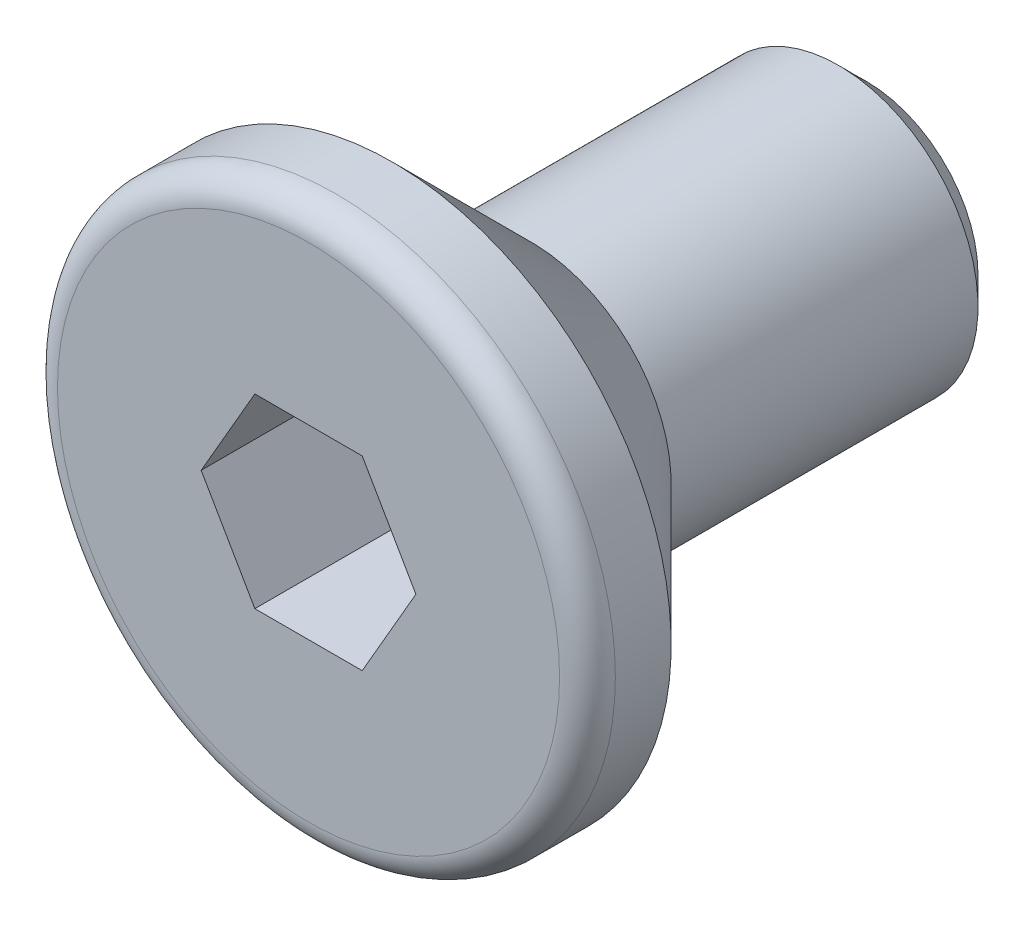
from build123d import *

# Parameters (mm, degrees)
CUT_EXTRUDE_1_DEPTH = 1.5
FILLET_1_R          = 0.3


with BuildPart() as part:
    # 草图1 → 旋转1 (revolve)
    with BuildSketch(Plane(origin=(0, 0, 0), x_dir=(0, 0, -1), z_dir=(1, 0, 0)), mode=Mode.PRIVATE) as revolve_1_sk:
        Polygon((-3, 0), (-3, 3), (-2.1, 3), (-0.6, 1.5), (2.7, 1.5), (3, 1.2), (3, 0), align=None)
    revolve(revolve_1_sk.sketch.rotate(Axis((0, 0, -3), (0, 0, 1)), 90), axis=Axis((0, 0, -3), (0, 0, 1)))

    # 草图2 → 切除-拉伸1 (cut)
    with BuildSketch(Plane.XY.offset(3)):
        Polygon((1.154700538, 0), (0.577350269, 1), (-0.577350269, 1), (-1.154700538, 0), (-0.577350269, -1), (0.577350269, -1), align=None)
    extrude(amount=-CUT_EXTRUDE_1_DEPTH, mode=Mode.SUBTRACT)

    # 圆角1
    fillet_1_edges = [part.edges().sort_by_distance(p)[0] for p in [
        (3, 0, 3),
    ]]
    fillet(fillet_1_edges, radius=FILLET_1_R)


solid = part.part
